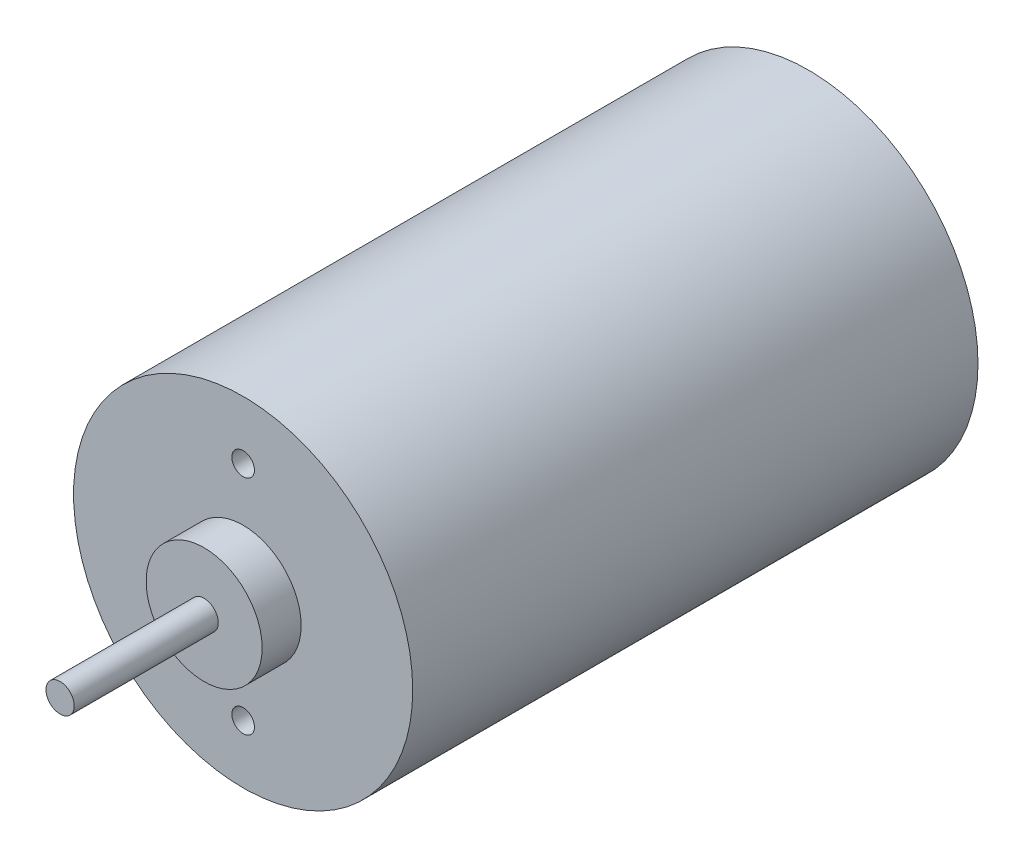
from build123d import *

# Parameters (mm, degrees)
SKETCH1_R           = 19.05
BOSS_EXTRUDE1_DEPTH = 63.5
SKETCH2_R           = 6.5151
BOSS_EXTRUDE2_DEPTH = 4.3815
SKETCH3_R           = 1.5875
BOSS_EXTRUDE3_DEPTH = 16.1798
SKETCH4_R           = 1.27
CUT_EXTRUDE1_DEPTH  = 6.35


with BuildPart() as part:
    # Sketch1 → Boss-Extrude1 (new body)
    with BuildSketch(Plane.XY):
        Circle(SKETCH1_R)
    extrude(amount=BOSS_EXTRUDE1_DEPTH)

    # Sketch2 → Boss-Extrude2 (add)
    with BuildSketch(Plane.XY.offset(63.5)):
        Circle(SKETCH2_R)
    extrude(amount=BOSS_EXTRUDE2_DEPTH)

    # Sketch3 → Boss-Extrude3 (add)
    with BuildSketch(Plane.XY.offset(67.8815)):
        Circle(SKETCH3_R)
    extrude(amount=BOSS_EXTRUDE3_DEPTH)

    # Sketch4 → Cut-Extrude1 (cut)
    with BuildSketch(Plane.XY.offset(63.5)):
        with Locations((0, 12.5)):
            Circle(SKETCH4_R)
        with Locations((0, -12.5)):
            Circle(SKETCH4_R)
    extrude(amount=-CUT_EXTRUDE1_DEPTH, mode=Mode.SUBTRACT)


solid = part.part
